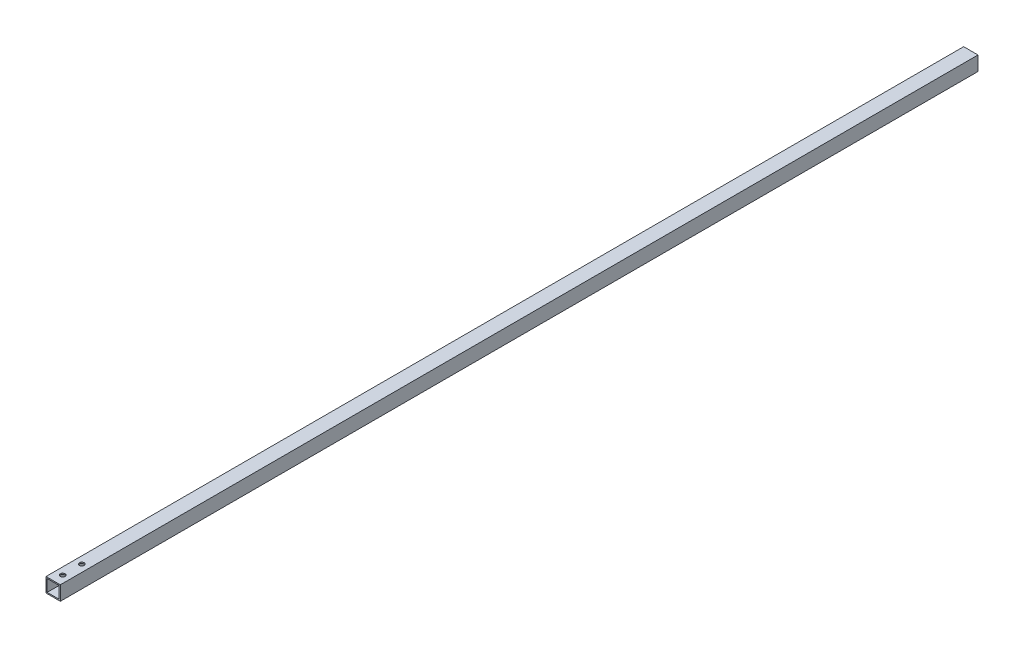
from build123d import *

# Parameters (mm, degrees)
SKETCH1_W               = 19.05
SKETCH1_H               = 19.05
SKETCH1_W_2             = 15.875
SKETCH1_H_2             = 15.875
BOSS_EXTRUDE1_DEPTH     = 609.6
CUT_EXTRUDE1_DEPTH      = 610.748809962
CUT_EXTRUDE1_DEPTH_BACK = 610.748809962
SKETCH2_R               = 3.175


with BuildPart() as part:
    # Sketch1 → Boss-Extrude1 (new, symmetric)
    with BuildSketch(Plane.XY):
        Rectangle(SKETCH1_W, SKETCH1_H)
        Rectangle(SKETCH1_W_2, SKETCH1_H_2, mode=Mode.SUBTRACT)
    extrude(amount=BOSS_EXTRUDE1_DEPTH, both=True)

    # Sketch2 → Cut-Extrude1 (cut, two sides: drawn at the far end of the back side and taken through both)
    with BuildSketch(Plane(origin=(0, 0, 0), x_dir=(1, 0, 0), z_dir=(0, 1, 0)).offset(-CUT_EXTRUDE1_DEPTH_BACK)):
        with Locations(Location((0, -596.9, 0), (0, 0, 270))):
            Circle(SKETCH2_R)
        with Locations(Location((0, -571.5, 0), (0, 0, 270))):
            Circle(SKETCH2_R)
    extrude(amount=CUT_EXTRUDE1_DEPTH + CUT_EXTRUDE1_DEPTH_BACK, mode=Mode.SUBTRACT)


solid = part.part
